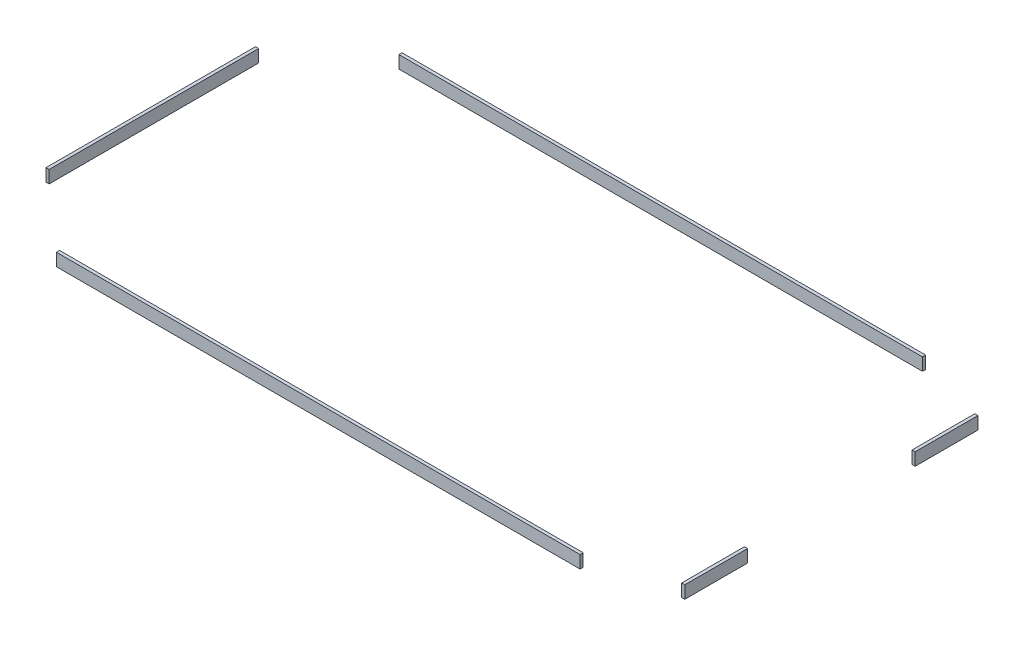
from build123d import *

# Parameters (mm, degrees)
MEMBER_20_X_20_1_DEPTH      = 324.25
MEMBER_20_X_20_1_DEPTH_BACK = 0.75
SKETCH1_W                   = 1.5
SKETCH1_H                   = 6
SKETCH1_ON_SEGMENT_2_W      = 1.5
SKETCH1_ON_SEGMENT_2_H      = 6
MEMBER_20_X_20_1_2_DEPTH    = 325
SKETCH1_ON_SEGMENT_3_W      = 1.5
SKETCH1_ON_SEGMENT_3_H      = 6
MEMBER_20_X_20_1_3_DEPTH    = 165.5
SKETCH1_ON_SEGMENT_4_W      = 1.5
SKETCH1_ON_SEGMENT_4_H      = 6
MEMBER_20_X_20_1_4_DEPTH    = 165.5
CUT_EXTRUDE_1_DEPTH         = 183.267660324
CUT_EXTRUDE_1_DEPTH_BACK    = 183.267660324
SKETCH_3_W                  = 40
SKETCH_3_H                  = 40
SKETCH_3_W_2                = 92.543604288
SKETCH_3_H_2                = 30.493794054
SKETCH_3_W_3                = 46.059335171
SKETCH_3_H_3                = 80


with BuildPart() as part:
    # Sketch1 → Member 20 X 20_1 (new, two sides: drawn at the far end of the back side and taken through both)
    with BuildSketch(Plane(origin=(161.75, 0, -81.75), x_dir=(0, 0, 1), z_dir=(-1, 0, 0)).offset(-MEMBER_20_X_20_1_DEPTH_BACK)):
        Rectangle(SKETCH1_W, SKETCH1_H)
    extrude(amount=MEMBER_20_X_20_1_DEPTH + MEMBER_20_X_20_1_DEPTH_BACK)


with BuildPart() as body_2:
    # Sketch1 on segment 2 (carried to segment 2) → Member 20 X 20_1 2 (new body)
    with BuildSketch(Plane(origin=(162.5, 0, 81.75), x_dir=(0, 0, 1), z_dir=(-1, 0, 0))):
        Rectangle(SKETCH1_ON_SEGMENT_2_W, SKETCH1_ON_SEGMENT_2_H)
    extrude(amount=MEMBER_20_X_20_1_2_DEPTH)


with BuildPart() as body_3:
    # Sketch1 on segment 3 (carried to segment 3) → Member 20 X 20_1 3 (new body)
    with BuildSketch(Plane(origin=(-161.75, 0, 82.75), x_dir=(-1, 0, 0), z_dir=(0, 0, -1))):
        Rectangle(SKETCH1_ON_SEGMENT_3_W, SKETCH1_ON_SEGMENT_3_H)
    extrude(amount=MEMBER_20_X_20_1_3_DEPTH)

    # Member 20 X 20_1 3 end butt 1
    split(bisect_by=Plane(origin=(-161.75, 0, 81), x_dir=(0, 1, 0), z_dir=(0, 0, -1)), keep=Keep.TOP)

    # Member 20 X 20_1 3 end butt 2
    split(bisect_by=Plane(origin=(-161.75, 0, -81), x_dir=(0, -1, 0), z_dir=(0, 0, 1)), keep=Keep.TOP)


with BuildPart() as body_4:
    # Sketch1 on segment 4 (carried to segment 4) → Member 20 X 20_1 4 (new body)
    with BuildSketch(Plane(origin=(161.75, 0, 82.75), x_dir=(-1, 0, 0), z_dir=(0, 0, -1))):
        Rectangle(SKETCH1_ON_SEGMENT_4_W, SKETCH1_ON_SEGMENT_4_H)
    extrude(amount=MEMBER_20_X_20_1_4_DEPTH)

    # Member 20 X 20_1 4 end butt 1
    split(bisect_by=Plane(origin=(161.75, 0, 81), x_dir=(0, 1, 0), z_dir=(0, 0, -1)), keep=Keep.TOP)

    # Member 20 X 20_1 4 end butt 2
    split(bisect_by=Plane(origin=(161.75, 0, -81), x_dir=(0, -1, 0), z_dir=(0, 0, 1)), keep=Keep.TOP)


with BuildPart() as cut_extrude_1_tool:
    # Эскиз3 → Вырез-Вытянуть1 (new, two sides: drawn at the far end of the back side and taken through both)
    with BuildSketch(Plane(origin=(0, 0, 0), x_dir=(1, 0, 0), z_dir=(0, 1, 0)).offset(-CUT_EXTRUDE_1_DEPTH_BACK)):
        with Locations((-145, 70)):
            Rectangle(SKETCH_3_W, SKETCH_3_H)
        with Locations((-145, -70)):
            Rectangle(SKETCH_3_W, SKETCH_3_H)
        with Locations((171.271802144, -85.246897027)):
            Rectangle(SKETCH_3_W_2, SKETCH_3_H_2)
        with Locations((150.205388499, 0)):
            Rectangle(SKETCH_3_W_3, SKETCH_3_H_3)
        with Locations((171.271802144, 85.246897027)):
            Rectangle(SKETCH_3_W_2, SKETCH_3_H_2)
    extrude(amount=CUT_EXTRUDE_1_DEPTH + CUT_EXTRUDE_1_DEPTH_BACK)


with BuildPart() as part_1:
    add(part.part)

    # Вырез-Вытянуть1: cut by cut_extrude_1_tool
    add(cut_extrude_1_tool.part, mode=Mode.SUBTRACT)


with BuildPart() as body_2_1:
    add(body_2.part)

    # Вырез-Вытянуть1: cut by cut_extrude_1_tool
    add(cut_extrude_1_tool.part, mode=Mode.SUBTRACT)


with BuildPart() as body_3_1:
    add(body_3.part)

    # Вырез-Вытянуть1: cut by cut_extrude_1_tool
    add(cut_extrude_1_tool.part, mode=Mode.SUBTRACT)


with BuildPart() as body_4_1:
    add(body_4.part)

    # Вырез-Вытянуть1: cut by cut_extrude_1_tool
    add(cut_extrude_1_tool.part, mode=Mode.SUBTRACT)


solid = Compound([part_1.part, body_2_1.part, body_3_1.part, body_4_1.part])
